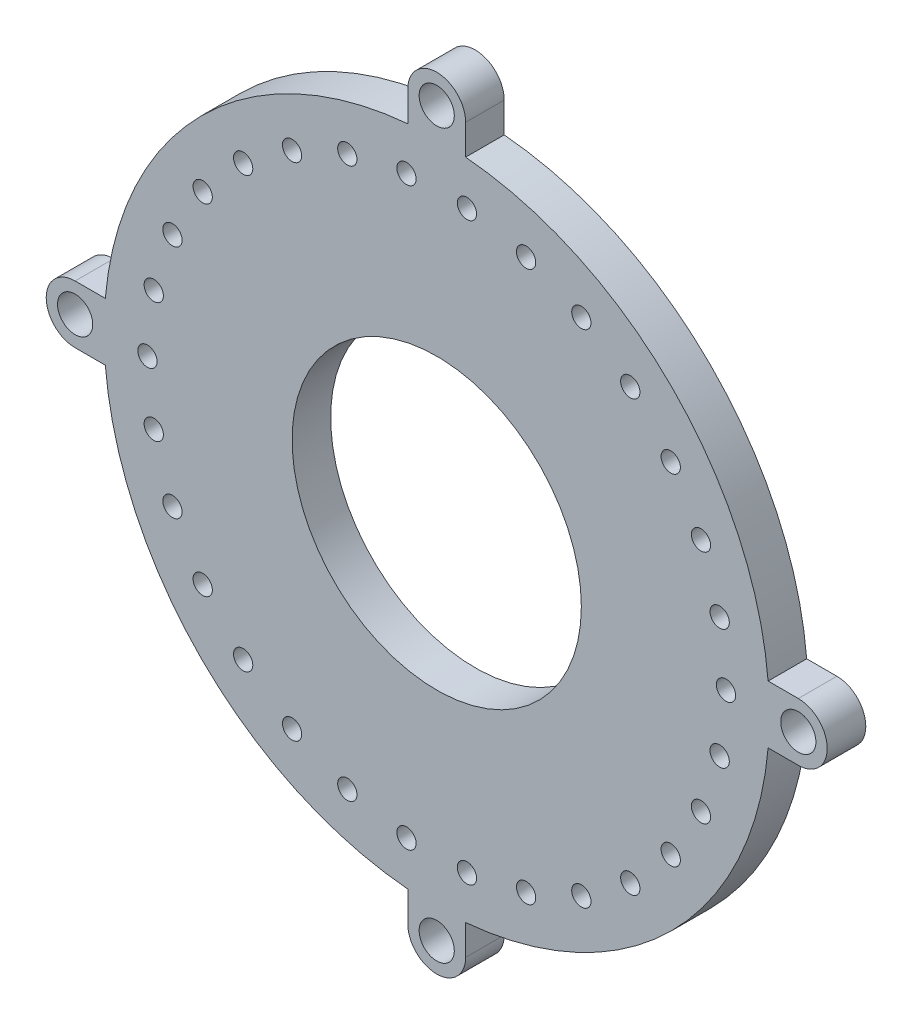
from build123d import *

# Parameters (mm, degrees)
SKETCH1_R                  = 54.76875
BOSS_EXTRUDE1_DEPTH        = 6.35
BOSS_EXTRUDE2_START        = -6.35
BOSS_EXTRUDE2_DEPTH        = 6.35
F_1_0_228_DIAMETER_HOLE1_D = 5.7912
SKETCH11_R                 = 1.5875
CUT_EXTRUDE1_DEPTH         = 3.175
SKETCH12_R                 = 23.8125
CUT_EXTRUDE2_DEPTH         = 92.146558235


with BuildPart() as part:
    # Sketch1 → Boss-Extrude1 (new body)
    with BuildSketch(Plane.XY):
        Circle(SKETCH1_R)
    extrude(amount=BOSS_EXTRUDE1_DEPTH)

    # Sketch7 → Boss-Extrude2 (add)
    with BuildSketch(Plane.XY.offset(6.35).offset(BOSS_EXTRUDE2_START)):
        with BuildLine():
            Line((-54.561291868, 4.7625), (-59.53125, 4.7625))
            ThreePointArc((-59.53125, 4.7625), (-64.29375, 0), (-59.53125, -4.7625))
            Line((-59.53125, -4.7625), (-54.561291868, -4.7625))
            ThreePointArc((-54.561291868, -4.7625), (-54.76875, 0), (-54.561291868, 4.7625))
        make_face()
        with BuildLine():
            Line((-4.7625, 59.53125), (-4.7625, 54.561291868))
            ThreePointArc((-4.7625, 54.561291868), (0, 54.76875), (4.7625, 54.561291868))
            Line((4.7625, 54.561291868), (4.7625, 59.53125))
            ThreePointArc((4.7625, 59.53125), (0, 64.29375), (-4.7625, 59.53125))
        make_face()
        with BuildLine():
            ThreePointArc((4.7625, -54.561291868), (0, -54.76875), (-4.7625, -54.561291868))
            Line((-4.7625, -54.561291868), (-4.7625, -59.53125))
            ThreePointArc((-4.7625, -59.53125), (0, -64.29375), (4.7625, -59.53125))
            Line((4.7625, -59.53125), (4.7625, -54.561291868))
        make_face()
        with BuildLine():
            Line((59.53125, 4.7625), (54.561291868, 4.7625))
            ThreePointArc((54.561291868, 4.7625), (54.76875, 0), (54.561291868, -4.7625))
            Line((54.561291868, -4.7625), (59.53125, -4.7625))
            ThreePointArc((59.53125, -4.7625), (64.29375, 0), (59.53125, 4.7625))
        make_face()
    extrude(amount=BOSS_EXTRUDE2_DEPTH)

    # #1 (0.228) Diameter Hole1 (through all)
    with Locations(Plane.XY.offset(6.35)):
        with Locations((-59.53125, 0), (0, 59.53125), (59.53125, 0), (0, -59.53125)):
            Hole(F_1_0_228_DIAMETER_HOLE1_D / 2)

    # Sketch11 → Cut-Extrude1 (cut)
    with BuildSketch(Plane.XY.offset(6.35)):
        with Locations((-47.625, 0)):
            Circle(SKETCH11_R)
        with Locations((-46.584279485, 9.901794275)):
            Circle(SKETCH11_R)
        with Locations((-43.50760242, 19.370832626)):
            Circle(SKETCH11_R)
        with Locations((-38.529434357, 27.99327264)):
            Circle(SKETCH11_R)
        with Locations((-31.867345128, 35.392272313)):
            Circle(SKETCH11_R)
        with Locations((-23.8125, 41.244459855)):
            Circle(SKETCH11_R)
        with Locations((-14.716934357, 45.294066589)):
            Circle(SKETCH11_R)
        with Locations((-4.978168063, 47.364105267)):
            Circle(SKETCH11_R)
        with Locations((4.978168063, 47.364105267)):
            Circle(SKETCH11_R)
        with Locations((14.716934357, 45.294066589)):
            Circle(SKETCH11_R)
        with Locations((23.8125, 41.244459855)):
            Circle(SKETCH11_R)
        with Locations((31.867345128, 35.392272313)):
            Circle(SKETCH11_R)
        with Locations((38.529434357, 27.99327264)):
            Circle(SKETCH11_R)
        with Locations((43.50760242, 19.370832626)):
            Circle(SKETCH11_R)
        with Locations((46.584279485, 9.901794275)):
            Circle(SKETCH11_R)
        with Locations((47.625, 0)):
            Circle(SKETCH11_R)
        with Locations((46.584279485, -9.901794275)):
            Circle(SKETCH11_R)
        with Locations((43.50760242, -19.370832626)):
            Circle(SKETCH11_R)
        with Locations((38.529434357, -27.99327264)):
            Circle(SKETCH11_R)
        with Locations((31.867345128, -35.392272313)):
            Circle(SKETCH11_R)
        with Locations((23.8125, -41.244459855)):
            Circle(SKETCH11_R)
        with Locations((14.716934357, -45.294066589)):
            Circle(SKETCH11_R)
        with Locations((4.978168063, -47.364105267)):
            Circle(SKETCH11_R)
        with Locations((-4.978168063, -47.364105267)):
            Circle(SKETCH11_R)
        with Locations((-14.716934357, -45.294066589)):
            Circle(SKETCH11_R)
        with Locations((-23.8125, -41.244459855)):
            Circle(SKETCH11_R)
        with Locations((-31.867345128, -35.392272313)):
            Circle(SKETCH11_R)
        with Locations((-38.529434357, -27.99327264)):
            Circle(SKETCH11_R)
        with Locations((-43.50760242, -19.370832626)):
            Circle(SKETCH11_R)
        with Locations((-46.584279485, -9.901794275)):
            Circle(SKETCH11_R)
    extrude(amount=-CUT_EXTRUDE1_DEPTH, mode=Mode.SUBTRACT)

    # Sketch12 → Cut-Extrude2 (cut, through all)
    with BuildSketch(Plane.XY.offset(6.35)):
        Circle(SKETCH12_R)
    extrude(amount=-CUT_EXTRUDE2_DEPTH, mode=Mode.SUBTRACT)


solid = part.part
